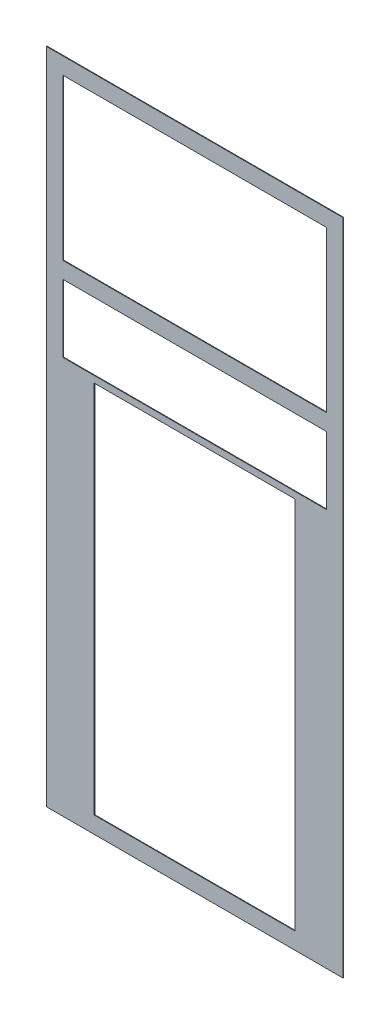
from build123d import *

# Parameters (mm, degrees)
CROQUIS1_W              = 900
CROQUIS1_H              = 1190.8
CROQUIS1_W_2            = 610
CROQUIS1_H_2            = 1120
SALIENTE_EXTRUIR1_DEPTH = 1.9
CROQUIS2_W              = 900
CROQUIS2_H              = 270
SALIENTE_EXTRUIR2_DEPTH = 1.9
CROQUIS4_W              = 800
CROQUIS4_H              = 220
CORTAR_EXTRUIR1_DEPTH   = 1.9
CROQUIS6_W              = 610
CROQUIS6_H              = 15
CORTAR_EXTRUIR2_DEPTH   = 10
CROQUIS7_W              = 800
CROQUIS7_H              = 14.9
SALIENTE_EXTRUIR3_DEPTH = 1.9
SALIENTE_EXTRUIR4_DEPTH = 1.9


with BuildPart() as part:
    # Croquis1 → Saliente-Extruir1 (new body)
    with BuildSketch(Plane.XY):
        with Locations((-450, 595.4)):
            Rectangle(CROQUIS1_W, CROQUIS1_H)
        with Locations((-450, 610.8)):
            Rectangle(CROQUIS1_W_2, CROQUIS1_H_2, mode=Mode.SUBTRACT)
    extrude(amount=SALIENTE_EXTRUIR1_DEPTH)

    # Croquis2 → Saliente-Extruir2 (add)
    with BuildSketch(Plane.XY.offset(1.9)):
        with Locations((-450, 1325.8)):
            Rectangle(CROQUIS2_W, CROQUIS2_H)
    extrude(amount=-SALIENTE_EXTRUIR2_DEPTH)

    # Croquis4 → Cortar-Extruir1 (cut)
    with BuildSketch(Plane.XY.offset(1.9)):
        with Locations((-450, 1315.8)):
            Rectangle(CROQUIS4_W, CROQUIS4_H)
    extrude(amount=-CORTAR_EXTRUIR1_DEPTH, mode=Mode.SUBTRACT)

    # Croquis6 → Cortar-Extruir2 (cut)
    with BuildSketch(Plane.XY.offset(1.9)):
        with Locations((-450, 1178.3)):
            Rectangle(CROQUIS6_W, CROQUIS6_H)
    extrude(amount=-CORTAR_EXTRUIR2_DEPTH, mode=Mode.SUBTRACT)

    # Croquis7 → Saliente-Extruir3 (add)
    with BuildSketch(Plane.XY.offset(1.9)):
        with Locations((-450, 1418.35)):
            Rectangle(CROQUIS7_W, CROQUIS7_H)
    extrude(amount=-SALIENTE_EXTRUIR3_DEPTH)

    # Croquis8 → Saliente-Extruir4 (add)
    with BuildSketch(Plane(origin=(0, 0, 0), x_dir=(-1, 0, 0), z_dir=(0, 0, -1))):
        Polygon((0, 1998), (0, 1460.8), (50.800000001, 1460.8), (50.8, 1947.2), (849.2, 1947.2), (849.200000001, 1460.8), (900, 1460.8), (900, 1998), align=None)
    extrude(amount=-SALIENTE_EXTRUIR4_DEPTH)


solid = part.part
